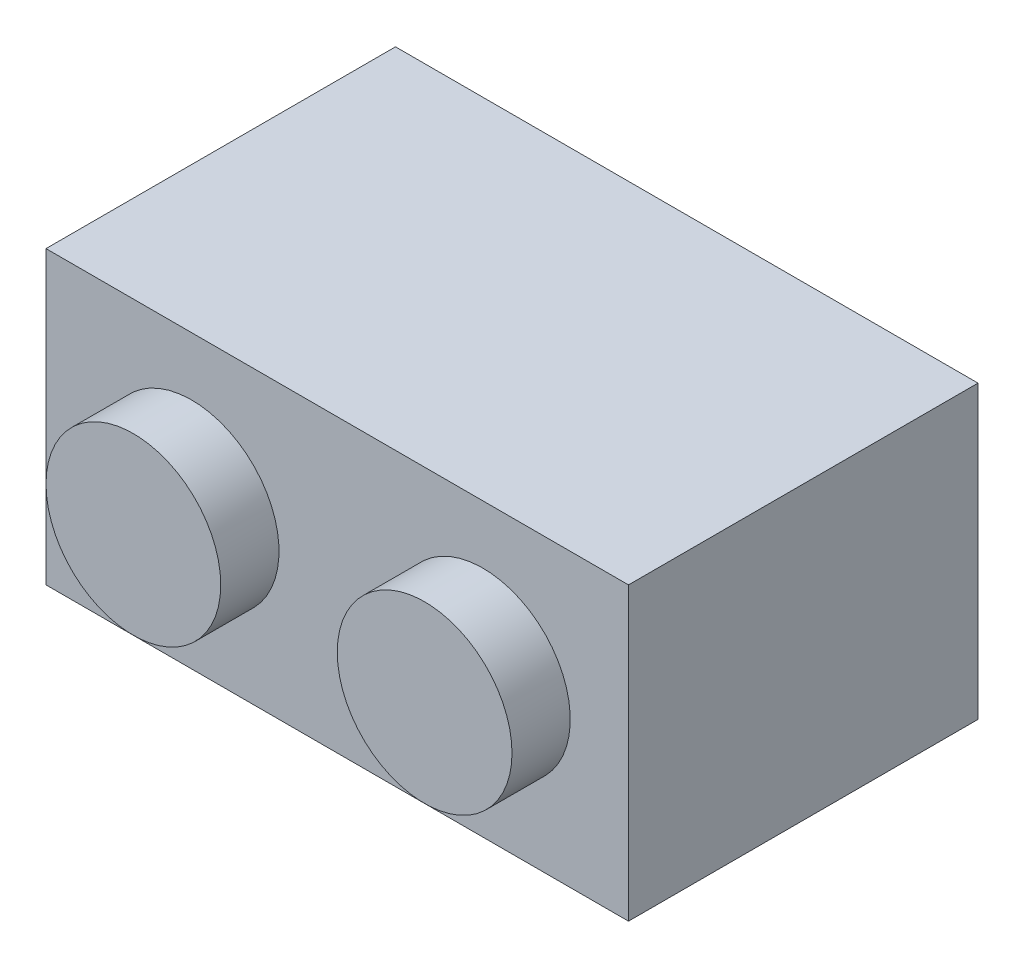
from build123d import *

# Parameters (mm, degrees)
SKETCH1_W           = 15.875
SKETCH1_H           = 7.9375
BOSS_EXTRUDE1_DEPTH = 9.525
SKETCH2_R           = 2.38125
BOSS_EXTRUDE2_DEPTH = 1.5875
LPATTERN1_COUNT     = 2
LPATTERN1_PITCH     = 7.9375
SHELL3_T            = -1.5875
SKETCH3_R           = 1.5875
BOSS_EXTRUDE3_DEPTH = 7.9375


with BuildPart() as part:
    # Sketch1 → Boss-Extrude1 (new body)
    with BuildSketch(Plane.XY):
        with Locations((7.9375, 3.96875)):
            Rectangle(SKETCH1_W, SKETCH1_H)
    extrude(amount=BOSS_EXTRUDE1_DEPTH)

    # Sketch2 → Boss-Extrude2 (add)
    with BuildSketch(Plane.XY.offset(9.525)):
        with Locations(Location((3.96875, 3.96875, 0), (0, 0, 180))):
            Circle(SKETCH2_R)
    boss_extrude2 = extrude(amount=BOSS_EXTRUDE2_DEPTH)

    # LPattern1: Boss-Extrude2 ×2
    with Locations(*[(i * LPATTERN1_PITCH, 0, 0) for i in range(1, LPATTERN1_COUNT)]):
        add(boss_extrude2)

    # Shell3
    shell3_openings = [part.faces().sort_by_distance(p)[0] for p in [
        (7.9375, 3.96875, 0),
    ]]
    offset(amount=SHELL3_T, openings=shell3_openings, kind=Kind.INTERSECTION)

    # Sketch3 → Boss-Extrude3 (add)
    with BuildSketch(Plane(origin=(0, 0, 7.9375), x_dir=(-1, 0, 0), z_dir=(0, 0, -1))):
        with Locations((-7.9375, 3.96875)):
            Circle(SKETCH3_R)
    extrude(amount=BOSS_EXTRUDE3_DEPTH)


solid = part.part
